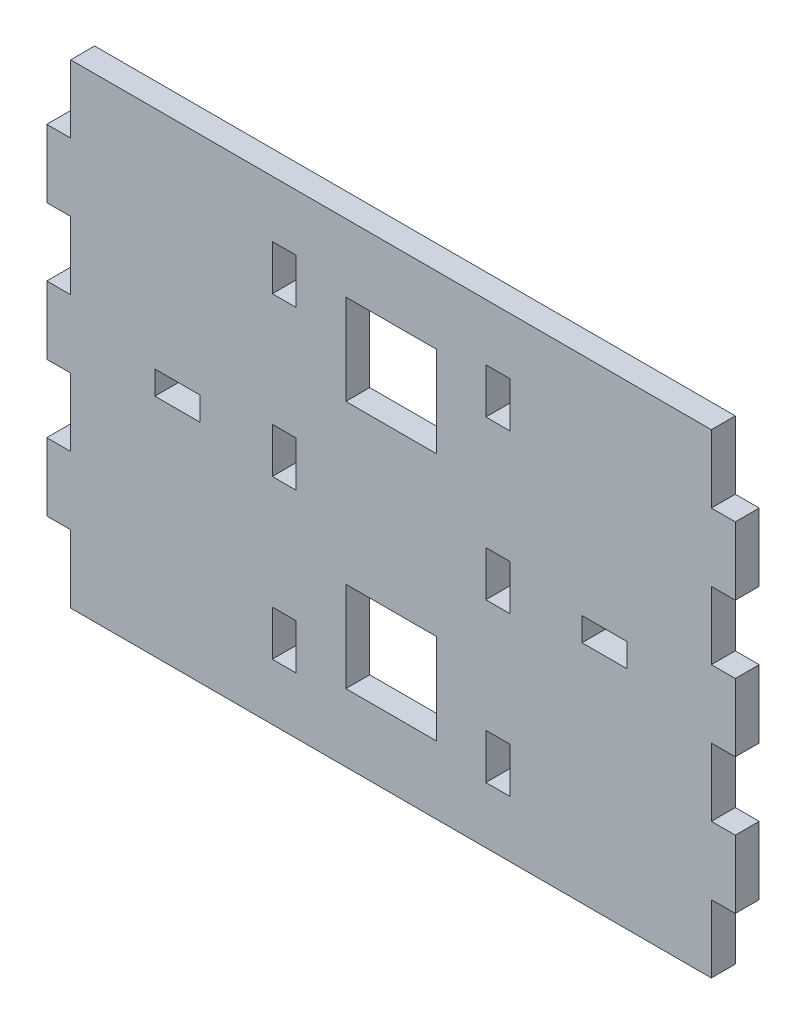
from build123d import *

# Parameters (mm, degrees)
SKETCH1_W           = 12
SKETCH1_H           = 12
SKETCH1_W_2         = 3.175
SKETCH1_H_2         = 6
SKETCH1_W_3         = 6
SKETCH1_H_3         = 3.125
BOSS_EXTRUDE1_DEPTH = 1.5875


with BuildPart() as part:
    # Sketch1 → Boss-Extrude1 (new, symmetric)
    with BuildSketch(Plane.XY):
        Polygon((45.675, 0), (45.675, 4.5), (42.5, 4.5), (42.5, 13.5), (45.675, 13.5), (45.675, 22.5), (42.5, 22.5), (42.5, 31.5), (-42.5, 31.5), (-42.5, 22.5), (-45.675, 22.5), (-45.675, 13.5), (-42.5, 13.5), (-42.5, 4.5), (-45.675, 4.5), (-45.675, -4.5), (-42.5, -4.5), (-42.5, -13.5), (-45.675, -13.5), (-45.675, -22.5), (-42.5, -22.5), (-42.5, -31.5), (42.5, -31.5), (42.5, -22.5), (45.675, -22.5), (45.675, -13.5), (42.5, -13.5), (42.5, -4.5), (45.675, -4.5), align=None)
        with Locations((0, -16.5)):
            Rectangle(SKETCH1_W, SKETCH1_H, mode=Mode.SUBTRACT)
        with Locations((0, 16.5)):
            Rectangle(SKETCH1_W, SKETCH1_H, mode=Mode.SUBTRACT)
        with Locations((14.166666667, -21)):
            Rectangle(SKETCH1_W_2, SKETCH1_H_2, mode=Mode.SUBTRACT)
        with Locations((14.166666667, 0)):
            Rectangle(SKETCH1_W_2, SKETCH1_H_2, mode=Mode.SUBTRACT)
        Polygon((31.333333333, 1.5625), (31.333333333, 0), (31.333333333, -1.5625), (25.333333333, -1.5625), (25.333333333, 1.5625), align=None, mode=Mode.SUBTRACT)
        with Locations((14.166666667, 21)):
            Rectangle(SKETCH1_W_2, SKETCH1_H_2, mode=Mode.SUBTRACT)
        with Locations((-14.166666667, 21)):
            Rectangle(SKETCH1_W_2, SKETCH1_H_2, mode=Mode.SUBTRACT)
        with Locations((-14.166666667, -21)):
            Rectangle(SKETCH1_W_2, SKETCH1_H_2, mode=Mode.SUBTRACT)
        with Locations((-28.333333333, 0)):
            Rectangle(SKETCH1_W_3, SKETCH1_H_3, mode=Mode.SUBTRACT)
        with Locations((-14.166666667, 0)):
            Rectangle(SKETCH1_W_2, SKETCH1_H_2, mode=Mode.SUBTRACT)
    extrude(amount=BOSS_EXTRUDE1_DEPTH, both=True)


solid = part.part
